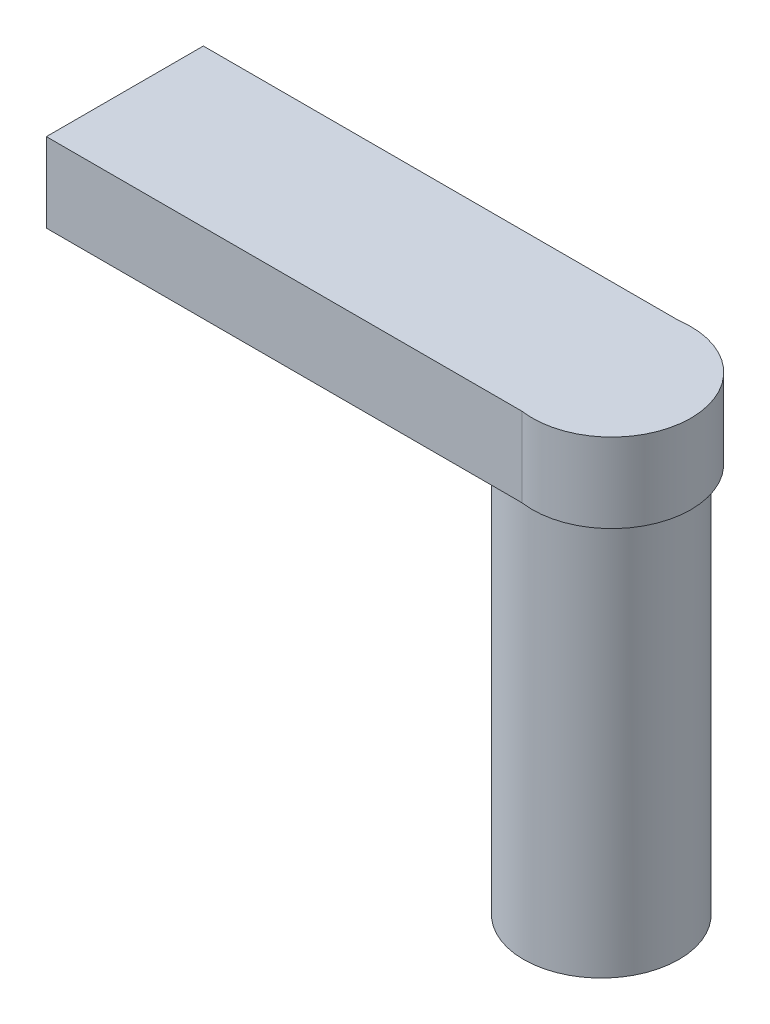
from build123d import *

# Parameters (mm, degrees)
SKETCH1_R           = 4.9
BOSS_EXTRUDE1_DEPTH = 25
BOSS_EXTRUDE2_DEPTH = 5


with BuildPart() as part:
    # Sketch1 → Boss-Extrude1 (new body)
    with BuildSketch(Plane(origin=(0, 0, 0), x_dir=(1, 0, 0), z_dir=(0, 1, 0))):
        with Locations(Location((0, 0, 0), (0, 0, 270))):
            Circle(SKETCH1_R)
    extrude(amount=BOSS_EXTRUDE1_DEPTH)

    # Sketch2 → Boss-Extrude2 (add)
    with BuildSketch(Plane(origin=(0, 25, 0), x_dir=(1, 0, 0), z_dir=(0, 1, 0))):
        with BuildLine():
            Line((0, 4.9), (-30, 4.9))
            Line((-30, 4.9), (-30, -5))
            Line((-30, -5), (0, -5))
            ThreePointArc((0, -5), (5.705336799, -0.05), (0, 4.9))
        make_face()
    extrude(amount=BOSS_EXTRUDE2_DEPTH)


solid = part.part
